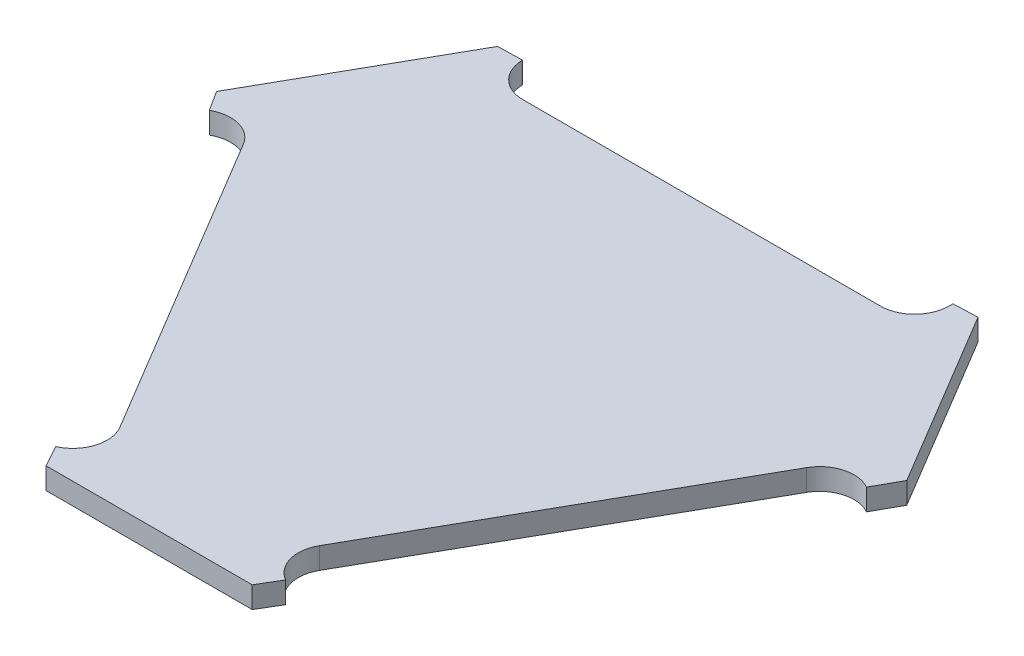
from build123d import *

# Parameters (mm, degrees)
BOSS_EXTRU_1_DEPTH = 10


with BuildPart() as part:
    # Esquisse1 → Boss.-Extru.1 (new body)
    with BuildSketch(Plane(origin=(0, 0, 0), x_dir=(1, 0, 0), z_dir=(0, 1, 0))):
        with BuildLine():
            Line((112.426746773, 8.058530984), (208.426746773, 8.058530984))
            Line((208.426746773, 8.058530984), (214.268189678, 17.812491045))
            ThreePointArc((214.268189678, 17.812491045), (206.831645665, 27.458673867), (208.340233589, 39.544830921))
            Line((208.340233589, 39.544830921), (290.262052013, 184.417099293))
            ThreePointArc((290.262052013, 184.417099293), (299.910234809, 191.958577714), (312.065160821, 190.468912764))
            Line((312.065160821, 190.468912764), (318.76181291, 202.523064381))
            Line((318.76181291, 202.523064381), (269.51839591, 284.931109389))
            Line((269.51839591, 284.931109389), (258.259283583, 284.517680144))
            Line((258.259283583, 284.517680144), (258.259283583, 282.707559459))
            ThreePointArc((258.259283583, 282.707559459), (253.572992082, 271.39385096), (242.259283583, 266.707559459))
            Line((242.259283583, 266.707559459), (75.828641942, 266.707559459))
            ThreePointArc((75.828641942, 266.707559459), (64.656934191, 271.253610536), (59.833620697, 282.308441218))
            Line((59.833620697, 282.308441218), (59.827222367, 282.56486004))
            Line((59.827222367, 282.56486004), (48.463462476, 282.281304065))
            Line((48.463462476, 282.281304065), (1.209576466, 198.716537226))
            Line((1.209576466, 198.716537226), (7.119810651, 189.400838648))
            ThreePointArc((7.119810651, 189.400838648), (19.083596298, 190.931024082), (28.716557185, 183.672945892))
            Line((28.716557185, 183.672945892), (114.087531018, 40.806031234))
            ThreePointArc((114.087531018, 40.806031234), (115.621763688, 27.817531222), (106.953563168, 18.023793314))
            Line((106.953563168, 18.023793314), (112.426746773, 8.058530984))
        make_face()
    extrude(amount=BOSS_EXTRU_1_DEPTH)


solid = part.part
